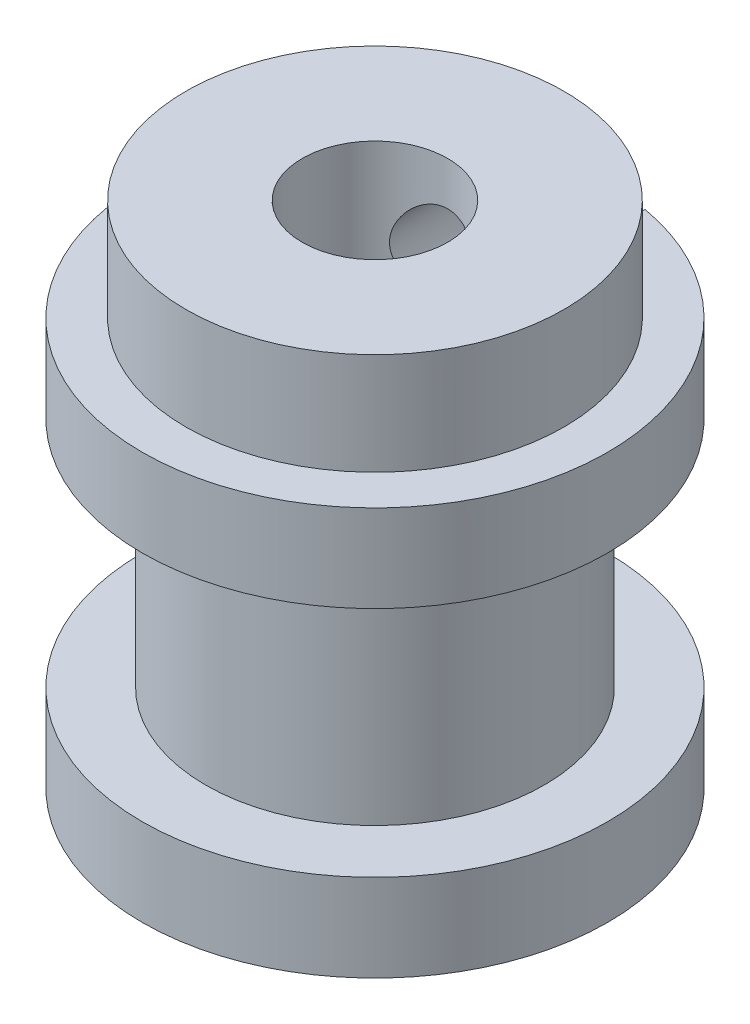
from build123d import *

# Parameters (mm, degrees)
ESQUISSE2_R             = 1.5
ENL_V_MAT_EXTRU_1_DEPTH = 16.43534904


with BuildPart() as part:
    # Esquisse1 → Révolution1 (revolve)
    with BuildSketch(Plane.XY, mode=Mode.PRIVATE) as r_volution1_sk:
        Polygon((2.5, -7), (2.5, 10.5), (6.5, 10.5), (6.5, 7), (8, 7), (8, 4), (5.82, 4), (5.82, -4), (8, -4), (8, -7), align=None)
    revolve(r_volution1_sk.sketch.rotate(Axis((0, 5.91926869, 0), (0, -1, 0)), 90), axis=Axis((0, 5.91926869, 0), (0, -1, 0)))

    # Esquisse2 → Enlèv. mat.-Extru.1 (cut, through all)
    with BuildSketch(Plane.XY):
        with Locations((0, 7.5)):
            Circle(ESQUISSE2_R)
    extrude(amount=-ENL_V_MAT_EXTRU_1_DEPTH, mode=Mode.SUBTRACT)


solid = part.part
